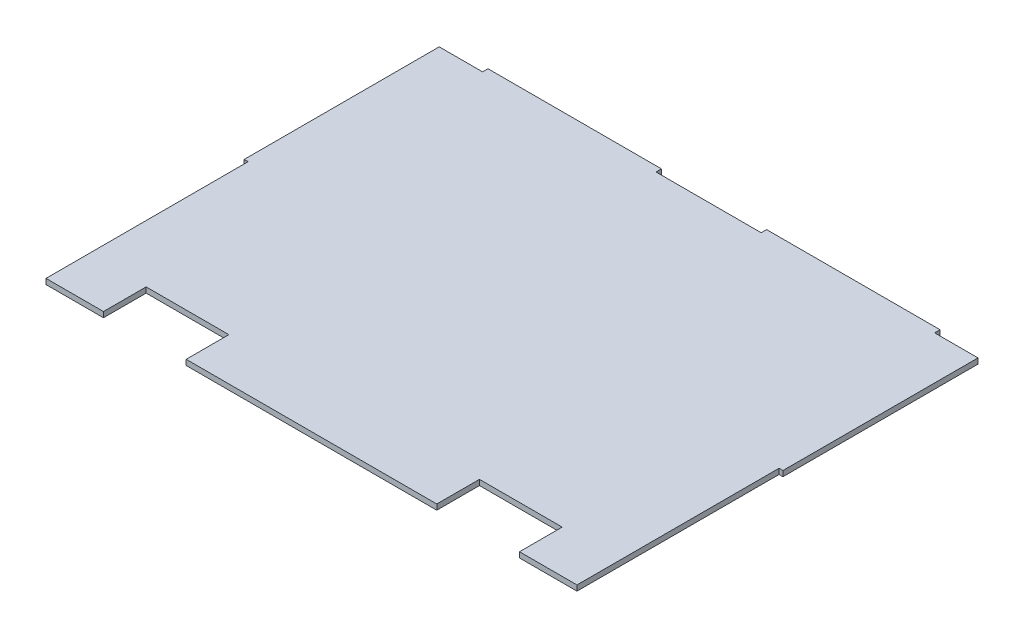
from build123d import *

# Parameters (mm, degrees)
SKETCH1_W           = 315.575
SKETCH1_H           = 3.175
BOSS_EXTRUDE1_DEPTH = 235.775
SKETCH3_W           = 25.4
SKETCH3_H           = 3.175
SKETCH3_W_2         = 61.575
CUT_EXTRUDE1_DEPTH  = 3.175
CUT_EXTRUDE2_START  = -3.175
SKETCH5_W           = 2.286
SKETCH5_H           = 118.364
CUT_EXTRUDE2_DEPTH  = 287.894626403
SKETCH6_W           = 48.454093678
SKETCH6_H           = 25
CUT_EXTRUDE4_DEPTH  = 284.719626403


with BuildPart() as part:
    # Sketch1 → Boss-Extrude1 (new body)
    with BuildSketch(Plane.XY):
        Rectangle(SKETCH1_W, SKETCH1_H)
    extrude(amount=BOSS_EXTRUDE1_DEPTH)

    # Sketch3 → Cut-Extrude1 (cut)
    with BuildSketch(Plane(origin=(0, 0, 0), x_dir=(-1, 0, 0), z_dir=(0, 0, -1))):
        with Locations((-145.0875, 0)):
            Rectangle(SKETCH3_W, SKETCH3_H)
        Rectangle(SKETCH3_W_2, SKETCH3_H)
        with Locations((145.0875, 0)):
            Rectangle(SKETCH3_W, SKETCH3_H)
    extrude(amount=-CUT_EXTRUDE1_DEPTH, mode=Mode.SUBTRACT)

    # Sketch5 → Cut-Extrude2 (cut)
    with BuildSketch(Plane(origin=(0, 1.5875, 0), x_dir=(1, 0, 0), z_dir=(0, 1, 0)).offset(CUT_EXTRUDE2_START)):
        with Locations((-156.6445, -176.593)):
            Rectangle(SKETCH5_W, SKETCH5_H)
    cut_extrude2 = extrude(amount=CUT_EXTRUDE2_DEPTH, mode=Mode.SUBTRACT)

    # Mirror1: Cut-Extrude2 across plane
    add(cut_extrude2.mirror(Plane(origin=(0, 0, 0), x_dir=(0, 0, 1), z_dir=(1, 0, 0))), mode=Mode.SUBTRACT)

    # Sketch6 → Cut-Extrude4 (cut, through all)
    with BuildSketch(Plane(origin=(0, 1.5875, 0), x_dir=(1, 0, 0), z_dir=(0, 1, 0))):
        with Locations((-97.616032964, -223.275)):
            Rectangle(SKETCH6_W, SKETCH6_H)
    cut_extrude4 = extrude(amount=-CUT_EXTRUDE4_DEPTH, mode=Mode.SUBTRACT)

    # Mirror2: Cut-Extrude4 across plane
    add(cut_extrude4.mirror(Plane(origin=(0, 0, 0), x_dir=(0, 0, 1), z_dir=(1, 0, 0))), mode=Mode.SUBTRACT)


solid = part.part
